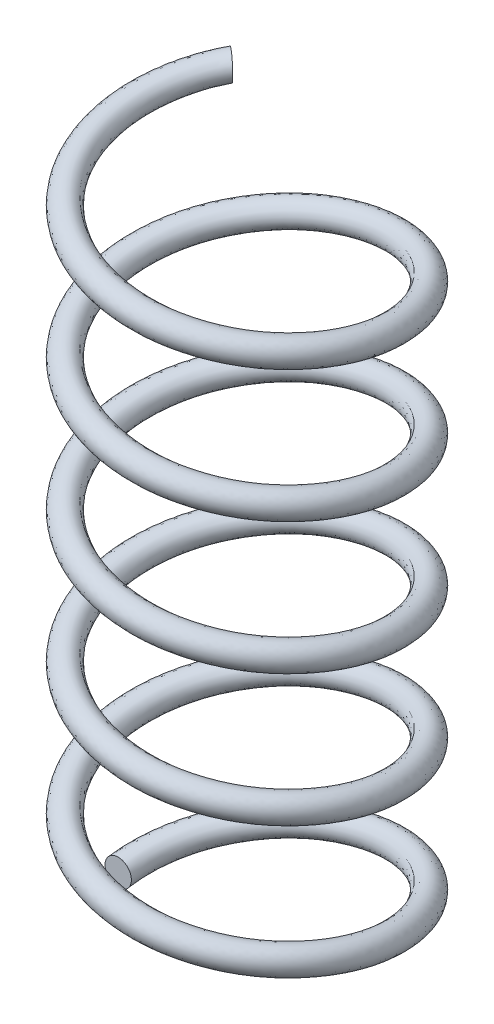
from build123d import *

# Parameters (mm, degrees)
SWEEP1_PITCH       = 2.25
SWEEP1_HEIGHT      = 11.5
SWEEP1_RADIUS      = 2.2
SWEEP1_START_ANGLE = -90
SKETCH3_R          = 0.225


with BuildPart() as part:
    # Sweep1: sweep along a helix
    with BuildLine() as sweep1_path:
        add(Helix(SWEEP1_PITCH, SWEEP1_HEIGHT, SWEEP1_RADIUS, center=(0, 0, 0), direction=(0, 1, 0), lefthand=True, mode=Mode.PRIVATE).rotate(Axis((0, 0, 0), (0, 1, 0)), SWEEP1_START_ANGLE))
    # Sketch3 → Sweep1 (sweep)
    with BuildSketch(Plane.XY):
        with Locations((-2.2, 0)):
            Circle(SKETCH3_R)
    sweep(path=sweep1_path.line, is_frenet=True)


solid = part.part
